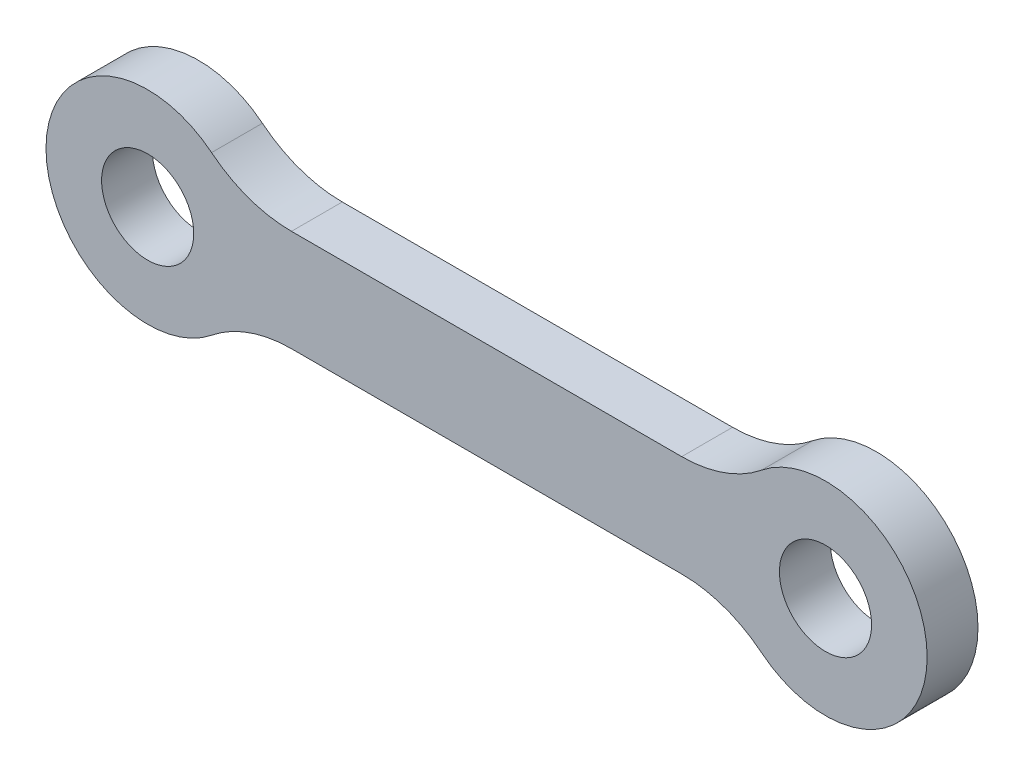
from build123d import *

# Parameters (mm, degrees)
SKETCH1_R           = 4.60375
BOSS_EXTRUDE1_DEPTH = 5.08


with BuildPart() as part:
    # Sketch1 → Boss-Extrude1 (new body)
    with BuildSketch(Plane.XY):
        with BuildLine():
            Line((14.368409794, 5.08), (53.36492354, 5.08))
            ThreePointArc((53.36492354, 5.08), (57.598256873, 5.806325172), (61.347373425, 7.902222222))
            ThreePointArc((61.347373425, 7.902222222), (77.893333333, 0), (61.347373425, -7.902222222))
            ThreePointArc((61.347373425, -7.902222222), (57.598256873, -5.806325172), (53.36492354, -5.08))
            Line((53.36492354, -5.08), (14.368409794, -5.08))
            ThreePointArc((14.368409794, -5.08), (10.13507646, -5.806325172), (6.385959908, -7.902222222))
            ThreePointArc((6.385959908, -7.902222222), (-10.16, 0), (6.385959908, 7.902222222))
            ThreePointArc((6.385959908, 7.902222222), (10.13507646, 5.806325172), (14.368409794, 5.08))
        make_face()
        Circle(SKETCH1_R, mode=Mode.SUBTRACT)
        with Locations((67.733333333, 0)):
            Circle(SKETCH1_R, mode=Mode.SUBTRACT)
    extrude(amount=BOSS_EXTRUDE1_DEPTH)


solid = part.part
